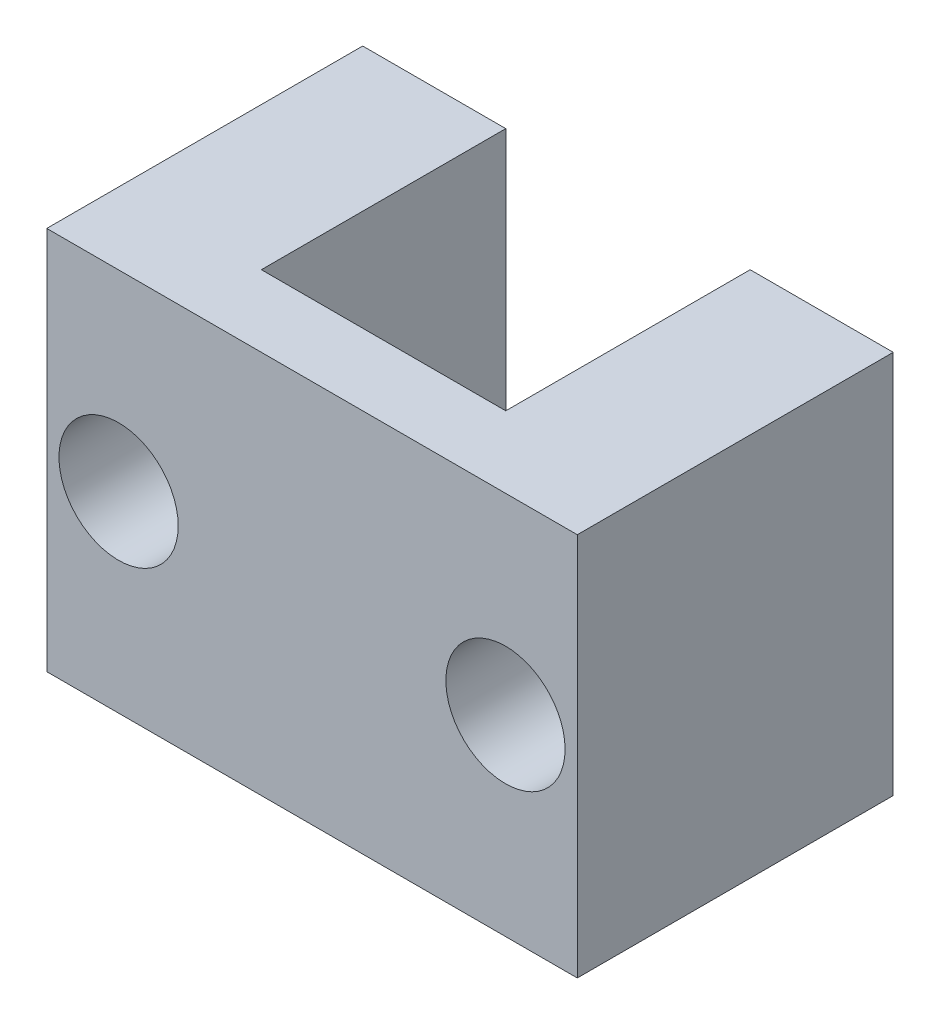
from build123d import *

# Parameters (mm, degrees)
SKETCH1_W                                           = 44.5
SKETCH1_H                                           = 32.2
BOSS_EXTRUDE1_DEPTH                                 = 6
SKETCH2_W                                           = 12
SKETCH2_H                                           = 32.2
BOSS_EXTRUDE2_DEPTH                                 = 20.5
CBORE_FOR_M5_HEX_SOCKET_HEAD_CAP_SCREW1_D           = 5.8
CBORE_FOR_M5_HEX_SOCKET_HEAD_CAP_SCREW1_CBORE_D     = 10
CBORE_FOR_M5_HEX_SOCKET_HEAD_CAP_SCREW1_CBORE_DEPTH = 7.4
SKETCH6_W                                           = 18.5
SKETCH6_H                                           = 30.2
CUT_EXTRUDE1_DEPTH                                  = 1


with BuildPart() as part:
    # Sketch1 → Boss-Extrude1 (new body)
    with BuildSketch(Plane.XY):
        with Locations((22.25, 16.1)):
            Rectangle(SKETCH1_W, SKETCH1_H)
    extrude(amount=BOSS_EXTRUDE1_DEPTH)

    # Sketch2 → Boss-Extrude2 (add)
    with BuildSketch(Plane(origin=(0, 0, 0), x_dir=(-1, 0, 0), z_dir=(0, 0, -1))):
        with Locations((-38.5, 16.1)):
            Rectangle(SKETCH2_W, SKETCH2_H)
        with Locations((-6, 16.1)):
            Rectangle(SKETCH2_W, SKETCH2_H)
    extrude(amount=BOSS_EXTRUDE2_DEPTH)

    # CBORE for M5 Hex Socket Head Cap Screw1 (through all)
    with Locations(Plane.XY.offset(6)):
        with Locations((6.025, 16.1), (38.475, 16.1)):
            CounterBoreHole(CBORE_FOR_M5_HEX_SOCKET_HEAD_CAP_SCREW1_D / 2, CBORE_FOR_M5_HEX_SOCKET_HEAD_CAP_SCREW1_CBORE_D / 2, CBORE_FOR_M5_HEX_SOCKET_HEAD_CAP_SCREW1_CBORE_DEPTH)

    # Sketch6 → Cut-Extrude1 (cut)
    with BuildSketch(Plane(origin=(0, 0, 0), x_dir=(-1, 0, 0), z_dir=(0, 0, -1))):
        with Locations((-22.25, 16.1)):
            Rectangle(SKETCH6_W, SKETCH6_H)
    extrude(amount=-CUT_EXTRUDE1_DEPTH, mode=Mode.SUBTRACT)


solid = part.part
